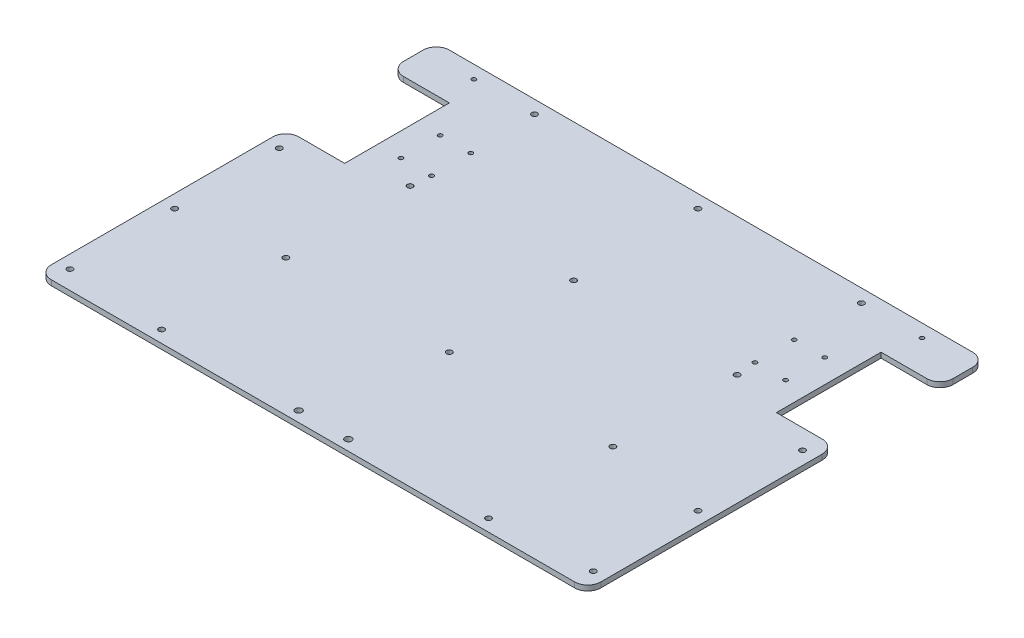
from build123d import *

# Parameters (mm, degrees)
SKETCH_1_W             = 420
SKETCH_1_H             = 304.2
SKETCH_1_R             = 2.55
EXTRUDE_1_DEPTH        = 4
SKETCH_2_R             = 1.6
SKETCH_2_W             = 45
SKETCH_2_H             = 80
CUT_EXTRUDE_1_DEPTH    = 260.326840107
SKETCH_4_R             = 2.15
CUT_EXTRUDE_3_DEPTH    = 260.326840107
PATTERN_LINEAR_3_COUNT = 4
PATTERN_LINEAR_3_PITCH = 95
SKETCH_7_R             = 2.15
SKETCH_7_R_2           = 1.6
CUT_EXTRUDE_5_DEPTH    = 260.326840107
SKETCH_9_R             = 2.15
EXTRUDE_2_DEPTH        = 4
FILLET_1_R             = 10


with BuildPart() as part:
    # 草图1 → 凸台-拉伸1 (new body)
    with BuildSketch(Plane(origin=(0, 0, 0), x_dir=(1, 0, 0), z_dir=(0, 1, 0))):
        Rectangle(SKETCH_1_W, SKETCH_1_H)
        with Locations(Location((-19, -144.1, 0), (0, 0, 270))):
            Circle(SKETCH_1_R, mode=Mode.SUBTRACT)
        with Locations(Location((19, -144.1, 0), (0, 0, 270))):
            Circle(SKETCH_1_R, mode=Mode.SUBTRACT)
    extrude(amount=EXTRUDE_1_DEPTH)

    # 草图2 → 切除-拉伸1 (cut, through all)
    with BuildSketch(Plane(origin=(0, 0, 0), x_dir=(1, 0, 0), z_dir=(0, 1, 0))):
        with Locations(Location((-147, 92.1, 0), (0, 0, 270))):
            Circle(SKETCH_2_R)
        with Locations(Location((-147, 62.1, 0), (0, 0, 270))):
            Circle(SKETCH_2_R)
        with Locations(Location((-123.6, 62.1, 0), (0, 0, 270))):
            Circle(SKETCH_2_R)
        with Locations(Location((-123.6, 92.1, 0), (0, 0, 270))):
            Circle(SKETCH_2_R)
        with Locations((-187.5, 77.1)):
            Rectangle(SKETCH_2_W, SKETCH_2_H)
    cut_extrude_1 = extrude(amount=CUT_EXTRUDE_1_DEPTH, mode=Mode.SUBTRACT)

    # 镜向1: 切除-拉伸1 across plane
    add(cut_extrude_1.mirror(Plane(origin=(0, 0, 0), x_dir=(0, 0, 1), z_dir=(1, 0, 0))), mode=Mode.SUBTRACT)

    # 草图4 → 切除-拉伸3 (cut, through all)
    with BuildSketch(Plane(origin=(0, 0, 0), x_dir=(1, 0, 0), z_dir=(0, 1, 0))):
        with Locations(Location((-125, 142.1, 0), (0, 0, 270))):
            Circle(SKETCH_4_R)
        with Locations(Location((125, 142.1, 0), (0, 0, 270))):
            Circle(SKETCH_4_R)
        with Locations(Location((0, 142.1, 0), (0, 0, 270))):
            Circle(SKETCH_4_R)
    cut_extrude_3 = extrude(amount=CUT_EXTRUDE_3_DEPTH, mode=Mode.SUBTRACT)

    # 阵列(线性)3: 切除-拉伸3 ×4
    with Locations(*[(0, 0, i * PATTERN_LINEAR_3_PITCH) for i in range(1, PATTERN_LINEAR_3_COUNT)]):
        add(cut_extrude_3, mode=Mode.SUBTRACT)

    # 草图7 → 切除-拉伸5 (cut, through all)
    with BuildSketch(Plane(origin=(0, 0, 0), x_dir=(1, 0, 0), z_dir=(0, 1, 0))):
        with Locations(Location((-200, 22.1, 0), (0, 0, 270))):
            Circle(SKETCH_7_R)
        with Locations(Location((-200, -137.9, 0), (0, 0, 270))):
            Circle(SKETCH_7_R)
        with Locations(Location((-200, -57.9, 0), (0, 0, 270))):
            Circle(SKETCH_7_R)
        with Locations(Location((200, -57.9, 0), (0, 0, 270))):
            Circle(SKETCH_7_R)
        with Locations(Location((200, 22.1, 0), (0, 0, 270))):
            Circle(SKETCH_7_R)
        with Locations(Location((200, -137.9, 0), (0, 0, 270))):
            Circle(SKETCH_7_R)
        with Locations(Location((-171.25, 142.1, 0), (0, 0, 270))):
            Circle(SKETCH_7_R_2)
        with Locations(Location((171.25, 142.1, 0), (0, 0, 270))):
            Circle(SKETCH_7_R_2)
        with Locations((171.25, -257.9)):
            Circle(SKETCH_7_R_2)
        with Locations((-171.25, -257.9)):
            Circle(SKETCH_7_R_2)
    extrude(amount=CUT_EXTRUDE_5_DEPTH, mode=Mode.SUBTRACT)

    # 草图9 → 凸台-拉伸2 (add, through all)
    with BuildSketch(Plane(origin=(0, 0, 0), x_dir=(1, 0, 0), z_dir=(0, 1, 0))):
        with Locations((0, -142.9)):
            Circle(SKETCH_9_R)
    extrude(amount=EXTRUDE_2_DEPTH)

    # 圆角1
    fillet_1_edges = [part.edges().sort_by_distance(p)[0] for p in [
        (-210, 2, -117.1),
        (-210, 2, -37.1),
        (210, 2, -37.1),
        (210, 2, -117.1),
        (-210, 2, -152.1),
        (210, 2, -152.1),
        (210, 2, 152.1),
        (-210, 2, 152.1),
    ]]
    fillet(fillet_1_edges, radius=FILLET_1_R)


solid = part.part
